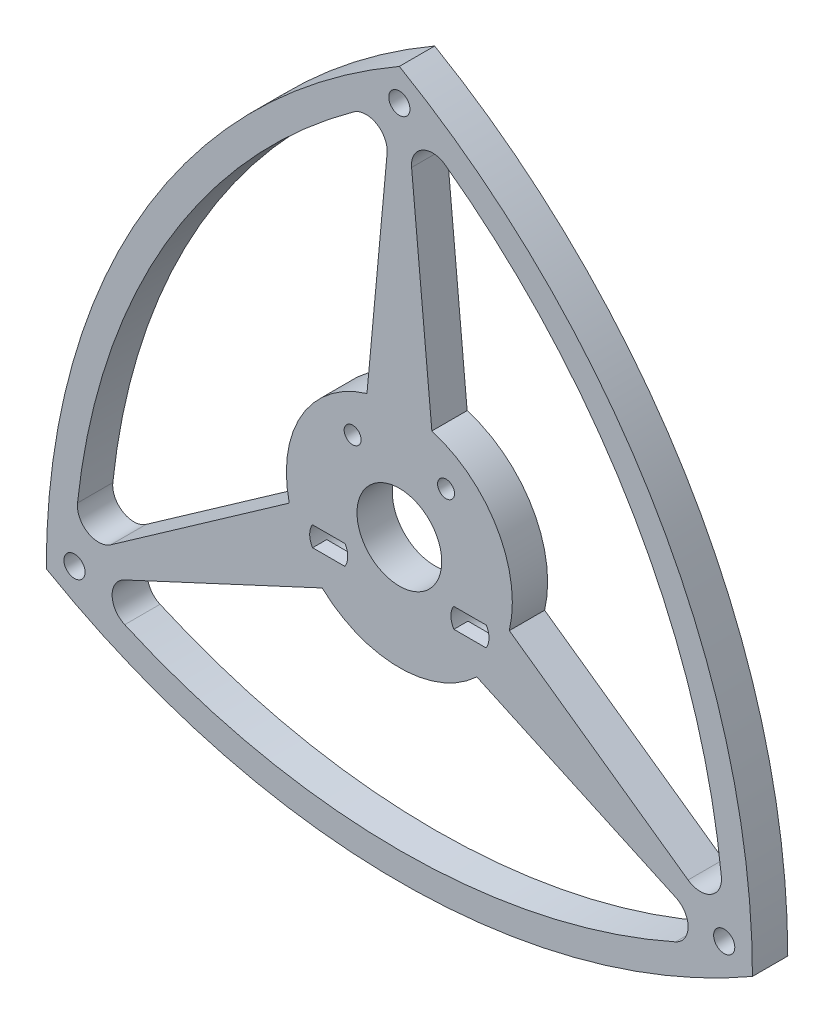
from build123d import *
from build123d.topology import SkipClean

# Parameters (mm, degrees)
SKETCH_1_R          = 6
SKETCH_1_R_2        = 1.5
SKETCH_1_R_3        = 1.2
EXTRUDE_3_DEPTH     = 5
SKETCH_1_128_R      = 2.1
SKETCH_1_128_R_2    = 2.694546499
CUT_EXTRUDE_1_DEPTH = 3


with BuildPart() as part:
    # 草图1 → 凸台-拉伸3 (new body)
    with BuildSketch(Plane.XY):
        with BuildLine():
            ThreePointArc((-50, -28.867513459), (0, -42.264973081), (50, -28.867513459))
            ThreePointArc((50, -28.867513459), (36.602540378, 21.132486541), (0, 57.735026919))
            ThreePointArc((0, 57.735026919), (-36.602540378, 21.132486541), (-50, -28.867513459))
        make_face()
        with BuildLine():
            Line((-12.318904501, -4.627679794), (-7.681095499, -4.627679794))
            ThreePointArc((-7.681095499, -4.627679794), (-7.305700474, -6.036481484), (-7.719101931, -7.434602674))
            Line((-7.719101931, -7.434602674), (-12.280898069, -7.434602674))
            ThreePointArc((-12.280898069, -7.434602674), (-12.694299526, -6.036481484), (-12.318904501, -4.627679794))
        make_face(mode=Mode.SUBTRACT)
        with BuildLine():
            ThreePointArc((-4.584422556, 15.329157506), (-13.835670885, 8.03580806), (-15.586551128, -3.613782498))
            Line((-15.586551128, -3.613782498), (-40.867216831, -21.36673515))
            ThreePointArc((-40.867216831, -21.36673515), (-44.11523634, -21.495718376), (-45.57409004, -18.590892513))
            ThreePointArc((-45.57409004, -18.590892513), (-33.183543116, 19.304197945), (-6.482898448, 48.912289883))
            ThreePointArc((-6.482898448, 48.912289883), (-3.236245956, 49.092161401), (-1.732813457, 46.208969266))
            Line((-1.732813457, 46.208969266), (-4.57661325, 15.413723751))
            Line((-4.57661325, 15.413723751), (-4.584422556, 15.329157506))
        make_face(mode=Mode.SUBTRACT)
        with BuildLine():
            Line((4.60262837, 15.323700992), (4.594769235, 15.408321271))
            Line((4.594769235, 15.408321271), (1.734391802, 46.206359162))
            ThreePointArc((1.734391802, 46.206359162), (3.23701886, 49.090744976), (6.484377608, 48.91121571))
            ThreePointArc((6.484377608, 48.91121571), (33.24460594, 19.198599415), (45.599673385, -18.831673998))
            ThreePointArc((45.599673385, -18.831673998), (44.131781944, -21.73382662), (40.882557513, -21.593342745))
            Line((40.882557513, -21.593342745), (15.64187559, -3.722901655))
            Line((15.64187559, -3.722901655), (15.57251534, -3.673794493))
            ThreePointArc((15.57251534, -3.673794493), (13.855876537, 8.000917785), (4.60262837, 15.323700992))
        make_face(mode=Mode.SUBTRACT)
        with BuildLine():
            ThreePointArc((-10.923034521, -11.691335119), (0.030725767, -15.999970498), (10.967857029, -11.649296639))
            Line((10.967857029, -11.649296639), (39.141662126, -24.608662006))
            ThreePointArc((39.141662126, -24.608662006), (40.887936946, -27.352330968), (39.108544771, -30.074638556))
            ThreePointArc((39.108544771, -30.074638556), (0.120715527, -38.389897283), (-38.887875634, -30.17258796))
            ThreePointArc((-38.887875634, -30.17258796), (-40.674081889, -27.456751691), (-38.938338523, -24.708389561))
            Line((-38.938338523, -24.708389561), (-10.923034521, -11.691335119))
        make_face(mode=Mode.SUBTRACT)
        with BuildLine():
            ThreePointArc((7.719101931, -7.434602674), (7.305700474, -6.036481484), (7.681095499, -4.627679794))
            Line((7.681095499, -4.627679794), (12.318904501, -4.627679794))
            ThreePointArc((12.318904501, -4.627679794), (12.694299526, -6.036481484), (12.280898069, -7.434602674))
            Line((12.280898069, -7.434602674), (7.719101931, -7.434602674))
        make_face(mode=Mode.SUBTRACT)
        Circle(SKETCH_1_R, mode=Mode.SUBTRACT)
        with Locations((-46, -26.558112383)):
            Circle(SKETCH_1_R_2, mode=Mode.SUBTRACT)
        with Locations((46, -26.558112383)):
            Circle(SKETCH_1_R_2, mode=Mode.SUBTRACT)
        with Locations((0, 53.230084709)):
            Circle(SKETCH_1_R_2, mode=Mode.SUBTRACT)
        with Locations((-6.616406845, 9.232315636)):
            Circle(SKETCH_1_R_3, mode=Mode.SUBTRACT)
        with Locations((6.616406845, 9.232315636)):
            Circle(SKETCH_1_R_3, mode=Mode.SUBTRACT)
    extrude(amount=EXTRUDE_3_DEPTH)

    # 草图1<128> → 切除-拉伸1 (cut)
    with SkipClean():  # the faces are left unmerged after this step: merging them gives an invalid solid
        with BuildSketch(Plane.XY):
            with Locations((-6.616406845, 9.232315636)):
                Circle(SKETCH_1_128_R)
            with Locations((6.616406845, 9.232315636)):
                Circle(SKETCH_1_128_R)
            with Locations((-10, -6)):
                Circle(SKETCH_1_128_R_2)
            with Locations((10, -6)):
                Circle(SKETCH_1_128_R_2)
        extrude(amount=CUT_EXTRUDE_1_DEPTH, mode=Mode.SUBTRACT)


solid = part.part
